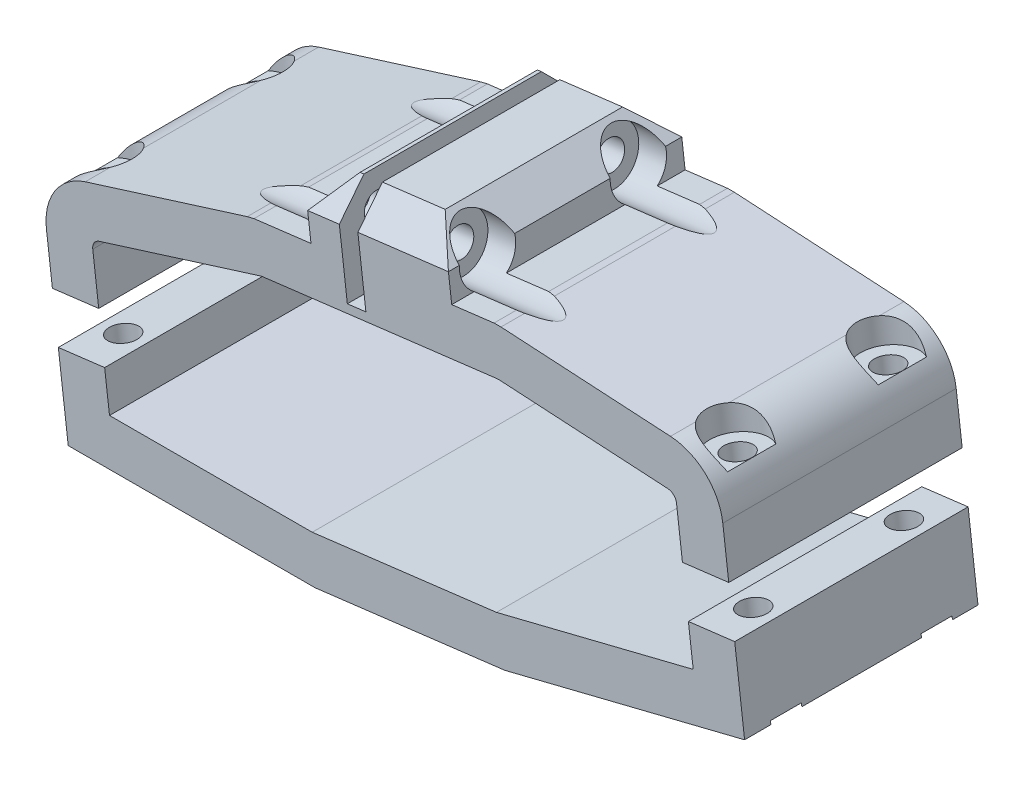
from build123d import *

# Parameters (mm, degrees)
BOSS_EXTRUDE1_START     = -30
BOSS_EXTRUDE1_DEPTH     = 25
CUT_EXTRUDE1_DEPTH      = 200.212466543
CUT_EXTRUDE2_DEPTH      = 74.573940041
CUT_EXTRUDE2_DEPTH_BACK = 74.573940041
SKETCH4_R               = 1.5
BOSS_EXTRUDE2_DEPTH     = 25
CHAMFER1_SIZE           = 3
CUT_EXTRUDE3_DEPTH      = 200.212466556
SKETCH9_R               = 1.5
CUT_EXTRUDE4_DEPTH      = 23
CUT_EXTRUDE5_DEPTH      = 13
CUT_EXTRUDE5_DEPTH_BACK = 3
SKETCH10_R              = 3
CUT_EXTRUDE6_DEPTH      = 10
CUT_EXTRUDE6_DEPTH_BACK = 1
SKETCH11_R              = 3
CUT_EXTRUDE7_START      = 24
SKETCH12_R              = 3
CUT_EXTRUDE7_DEPTH      = 10.5
CUT_EXTRUDE8_START      = -20
SKETCH12_2_R            = 3
CUT_EXTRUDE8_DEPTH      = 11.5


with BuildPart() as part:
    # Sketch1 → Boss-Extrude1 (new body)
    with BuildSketch(Plane.XY.offset(BOSS_EXTRUDE1_START)):
        with BuildLine():
            Line((-7.135244811, -176.134922093), (-5.90654434, -186.097898611))
            Line((-5.90654434, -186.097898611), (20.544956848, -186.062055605))
            Line((20.544956848, -186.062055605), (21.863824506, -185.899404082))
            Line((21.863824506, -185.899404082), (39.558058101, -183.71723361))
            Line((39.558058101, -183.71723361), (40.876925759, -183.554582086))
            Line((40.876925759, -183.554582086), (66.544563704, -177.162746503))
            Line((66.544563704, -177.162746503), (65.315864364, -167.19977916))
            Line((65.315864364, -167.19977916), (64.21019029, -158.234368073))
            ThreePointArc((64.21019029, -158.234368073), (62.359825624, -154.592360595), (58.606779742, -152.979067543))
            Line((58.606779742, -152.979067543), (57.69963552, -152.925836373))
            Line((57.69963552, -152.925836373), (40.448332133, -151.913530857))
            Line((40.448332133, -151.913530857), (39.706269034, -151.919483245))
            Line((39.706269034, -151.919483245), (13.994532739, -155.090425429))
            Line((13.994532739, -155.090425429), (13.273254168, -155.264943416))
            Line((13.273254168, -155.264943416), (-3.215189685, -160.438257336))
            Line((-3.215189685, -160.438257336), (-4.082188377, -160.710281573))
            ThreePointArc((-4.082188377, -160.710281573), (-7.330812495, -163.187058515), (-8.240888072, -167.169488066))
            Line((-8.240888072, -167.169488066), (-7.135244811, -176.134922093))
        make_face()
        with BuildLine():
            Line((-2.17283902, -175.522934545), (-1.486036695, -181.091904029))
            Line((-1.486036695, -181.091904029), (20.234429046, -181.062471795))
            Line((20.234429046, -181.062471795), (21.251827786, -180.936999421))
            Line((21.251827786, -180.936999421), (38.946061382, -178.754828949))
            Line((38.946061382, -178.754828949), (39.963460121, -178.629356576))
            Line((39.963460121, -178.629356576), (61.040262028, -173.38074536))
            Line((61.040262028, -173.38074536), (60.353459703, -167.81177588))
            Line((60.353459703, -167.81177588), (59.24778563, -158.846364793))
            ThreePointArc((59.24778563, -158.846364793), (58.939391519, -158.239363547), (58.313883872, -157.970481371))
            Line((58.313883872, -157.970481371), (57.40673965, -157.917250202))
            Line((57.40673965, -157.917250202), (40.321796652, -156.914706704))
            Line((40.321796652, -156.914706704), (40.03339474, -156.917020092))
            Line((40.03339474, -156.917020092), (14.891403395, -160.017697543))
            Line((14.891403395, -160.017697543), (14.611076875, -160.085524346))
            Line((14.611076875, -160.085524346), (-1.718365829, -165.208951032))
            Line((-1.718365829, -165.208951032), (-2.585364534, -165.480975273))
            ThreePointArc((-2.585364534, -165.480975273), (-3.126801887, -165.89377143), (-3.27848115, -166.557509688))
            Line((-3.27848115, -166.557509688), (-2.17283902, -175.522934545))
        make_face(mode=Mode.SUBTRACT)
    extrude(amount=-BOSS_EXTRUDE1_DEPTH)

    # Sketch3 → Cut-Extrude1 (cut, through all)
    with BuildSketch(Plane.XY.offset(-30)):
        Polygon((64.849127639, -163.41522211), (65.486290839, -168.58169038), (-10.214222473, -177.91758074), (-10.851385674, -172.75111247), align=None)
    extrude(amount=-CUT_EXTRUDE1_DEPTH, mode=Mode.SUBTRACT)


with BuildPart() as cut_extrude1_piece_1:
    # of the separate pieces the step leaves, piece 1, a body of its own (cut_extrude1_pieces)
    add(part.part.solids().sort_by_distance((-8.240888072, -167.169488066, -30))[0])


with BuildPart() as cut_extrude1_piece_2:
    # of the separate pieces the step leaves, piece 2, a body of its own (cut_extrude1_pieces)
    add(part.part.solids().sort_by_distance((-2.002412544, -176.904845769, -30))[0])


with BuildPart() as cut_extrude2_tool:
    # Sketch4 → Cut-Extrude2 (new, two sides: drawn at the far end of the back side and taken through both)
    with BuildSketch(Plane(origin=(20.823063867, -168.844808864, 0), x_dir=(0.9924809321078341, 0.12239934396215063, 0), z_dir=(0.12239934396215063, -0.9924809321078341, 0)).offset(-CUT_EXTRUDE2_DEPTH_BACK)):
        with Locations((-26.14037924, -50.601365925)):
            Circle(SKETCH4_R)
        with Locations((-26.14037924, -34.469122201)):
            Circle(SKETCH4_R)
        with Locations((41.859606666, -34.469122201)):
            Circle(SKETCH4_R)
        with Locations((41.859606666, -50.601365925)):
            Circle(SKETCH4_R)
    extrude(amount=CUT_EXTRUDE2_DEPTH + CUT_EXTRUDE2_DEPTH_BACK)


with BuildPart() as cut_extrude1_piece_1_1:
    add(cut_extrude1_piece_1.part)

    # Cut-Extrude2: cut by cut_extrude2_tool
    add(cut_extrude2_tool.part, mode=Mode.SUBTRACT)

    # Sketch5 → Boss-Extrude2 (add)
    with BuildSketch(Plane(origin=(0, 0, -55), x_dir=(-1, 0, 0), z_dir=(0, 0, -1))):
        Polygon((-35.172354477, -152.478635718), (-20.097243635, -154.337798567), (-19.375200501, -148.483077289), (-34.450311342, -146.62391444), align=None)
    extrude(amount=-BOSS_EXTRUDE2_DEPTH)

    # Chamfer1
    chamfer1_edges = [cut_extrude1_piece_1_1.edges().sort_by_distance(p)[0] for p in [
        (26.912755922, -147.553495865, -55),
        (19.375200501, -148.483077289, -42.5),
        (26.912755922, -147.553495865, -30),
        (34.450311342, -146.62391444, -42.5),
    ]]
    chamfer(chamfer1_edges, length=CHAMFER1_SIZE)

    # Sketch8 → Cut-Extrude3 (cut, through all)
    with BuildSketch(Plane(origin=(0, 0, -55), x_dir=(-1, 0, 0), z_dir=(0, 0, -1))):
        Polygon((-24.752975019, -147.819854398), (-25.120173051, -150.797297195), (-25.977098174, -157.745715521), (-23.992136309, -157.990514209), (-23.135211186, -151.042095882), (-22.768013155, -148.064653086), align=None)
    extrude(amount=-CUT_EXTRUDE3_DEPTH, mode=Mode.SUBTRACT)

    # Sketch9 → Cut-Extrude4 (cut)
    with BuildSketch(Plane(origin=(16.12246188, 1.988329139, 0), x_dir=(0, 0, -1), z_dir=(0.9924809321084809, 0.12239934395690713, 0))):
        with Locations(Location((34.130819832, -153.181711699, 0), (0, 0, 90))):
            Circle(SKETCH9_R)
        with Locations(Location((50.291452762, -153.181711699, 0), (0, 0, 90))):
            Circle(SKETCH9_R)
    extrude(amount=-CUT_EXTRUDE4_DEPTH, mode=Mode.SUBTRACT)

    # Sketch10 → Cut-Extrude5 (cut, two sides: drawn at the far end of the back side and taken through both)
    with BuildSketch(Plane(origin=(16.12246188, 1.988329139, 0), x_dir=(0, 0, -1), z_dir=(0.9924809321084809, 0.12239934395690713, 0)).offset(-CUT_EXTRUDE5_DEPTH_BACK)):
        with Locations(Location((34.130819832, -153.181711699, 0), (0, 0, 302.133963351))):
            Circle(SKETCH10_R)
        with Locations(Location((50.291452762, -153.181711699, 0), (0, 0, 302.133963351))):
            Circle(SKETCH10_R)
    extrude(amount=CUT_EXTRUDE5_DEPTH + CUT_EXTRUDE5_DEPTH_BACK, mode=Mode.SUBTRACT)

    # Sketch11 → Cut-Extrude6 (cut, two sides: drawn at the far end of the back side and taken through both)
    with BuildSketch(Plane(origin=(1.047351038, 0.12916629, 0), x_dir=(0, 0, 1), z_dir=(-0.9924809321084808, -0.12239934395690771, 0)).offset(-CUT_EXTRUDE6_DEPTH_BACK)):
        with Locations(Location((-34.130819832, -153.181711699, 0), (0, 0, 237.866036649))):
            Circle(SKETCH11_R)
        with Locations(Location((-50.291452762, -153.181711699, 0), (0, 0, 237.866036649))):
            Circle(SKETCH11_R)
    extrude(amount=CUT_EXTRUDE6_DEPTH + CUT_EXTRUDE6_DEPTH_BACK, mode=Mode.SUBTRACT)

    # Sketch12<2> → Cut-Extrude8 (cut)
    with BuildSketch(Plane(origin=(20.823063867, -168.844808864, 0), x_dir=(0.9924809321078341, 0.12239934396215063, 0), z_dir=(0.12239934396215063, -0.9924809321078341, 0)).offset(CUT_EXTRUDE8_START)):
        with Locations((-26.14037924, -50.601365925)):
            Circle(SKETCH12_2_R)
        with Locations((-26.14037924, -34.469122201)):
            Circle(SKETCH12_2_R)
    cut_extrude8 = extrude(amount=CUT_EXTRUDE8_DEPTH, mode=Mode.SUBTRACT)

    # Mirror2: Cut-Extrude8 across plane
    add(cut_extrude8.mirror(Plane(origin=(7.800509748, 0.9620107, 0), x_dir=(0, 0, 1), z_dir=(0.9924809321070012, 0.12239934396890495, 0))), mode=Mode.SUBTRACT)


with BuildPart() as cut_extrude1_piece_2_1:
    add(cut_extrude1_piece_2.part)

    # Cut-Extrude2: cut by cut_extrude2_tool
    add(cut_extrude2_tool.part, mode=Mode.SUBTRACT)

    # Sketch12 → Cut-Extrude7 (cut)
    with BuildSketch(Plane(origin=(20.823063867, -168.844808864, 0), x_dir=(0.9924809321078341, 0.12239934396215063, 0), z_dir=(0.12239934396215063, -0.9924809321078341, 0)).offset(CUT_EXTRUDE7_START)):
        with Locations((-26.14037924, -50.601365925)):
            Circle(SKETCH12_R)
        with Locations((-26.14037924, -34.469122201)):
            Circle(SKETCH12_R)
    cut_extrude7 = extrude(amount=-CUT_EXTRUDE7_DEPTH, mode=Mode.SUBTRACT)

    # Mirror1: Cut-Extrude7 across plane
    add(cut_extrude7.mirror(Plane(origin=(7.800509748, 0.9620107, 0), x_dir=(0, 0, 1), z_dir=(0.9924809321070012, 0.12239934396890495, 0))), mode=Mode.SUBTRACT)


solid = Compound([cut_extrude1_piece_1_1.part, cut_extrude1_piece_2_1.part])
